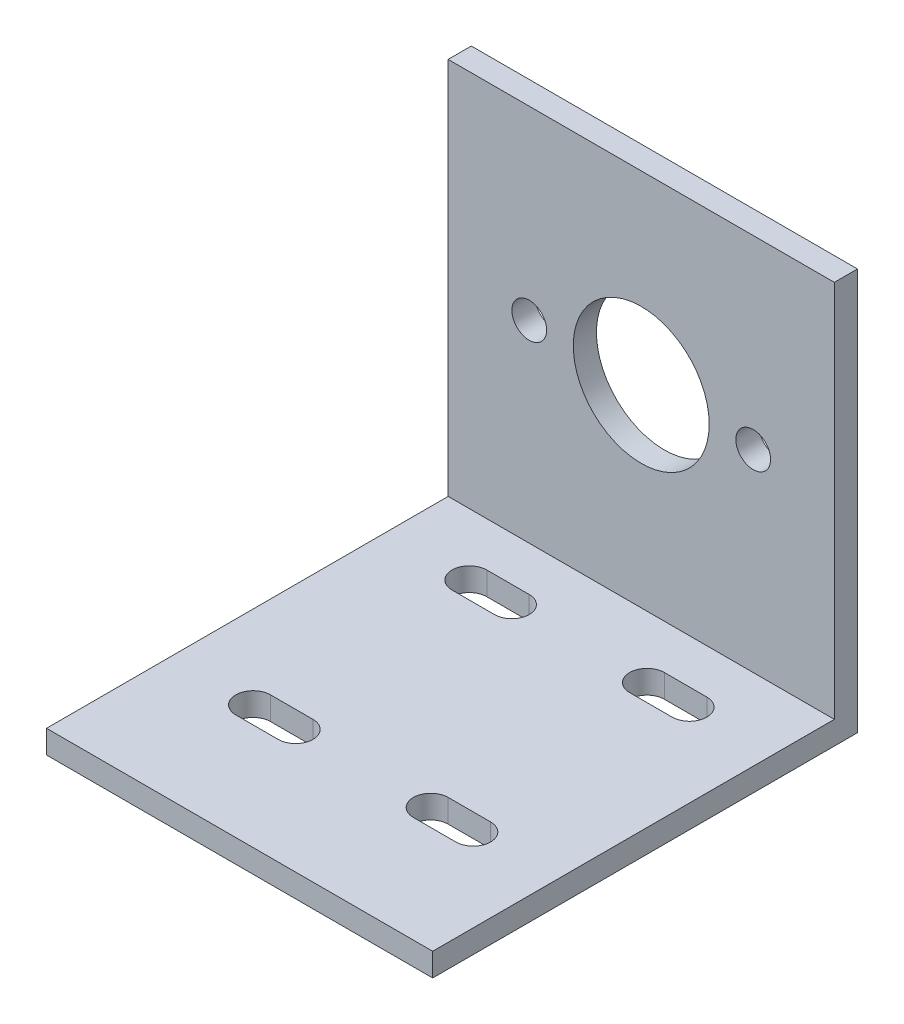
from build123d import *

# Parameters (mm, degrees)
SKIZZE1_W                       = 50
SKIZZE1_H                       = 52
SKIZZE1_R                       = 8.8
SKIZZE1_R_2                     = 2.25
AUFSATZ_LINEAR_AUSTRAGEN1_DEPTH = 3
SKIZZE2_W                       = 50
SKIZZE2_H                       = 2.999801306
AUFSATZ_LINEAR_AUSTRAGEN2_DEPTH = 52
SCHNITT_LINEAR_AUSTRAGEN1_DEPTH = 78.788299069


with BuildPart() as part:
    # Skizze1 → Aufsatz-Linear austragen1 (new body)
    with BuildSketch(Plane.XY):
        Rectangle(SKIZZE1_W, SKIZZE1_H)
        with Locations((0, 2)):
            Circle(SKIZZE1_R, mode=Mode.SUBTRACT)
        with Locations((-14.5, 2)):
            Circle(SKIZZE1_R_2, mode=Mode.SUBTRACT)
        with Locations((14.5, 2)):
            Circle(SKIZZE1_R_2, mode=Mode.SUBTRACT)
    extrude(amount=AUFSATZ_LINEAR_AUSTRAGEN1_DEPTH)

    # Skizze2 → Aufsatz-Linear austragen2 (add)
    with BuildSketch(Plane.XY.offset(3)):
        with Locations((0, -24.500099347)):
            Rectangle(SKIZZE2_W, SKIZZE2_H)
    extrude(amount=AUFSATZ_LINEAR_AUSTRAGEN2_DEPTH)

    # Skizze3 → Schnitt-Linear austragen1 (cut, through all)
    with BuildSketch(Plane(origin=(0, -23.000198694, 0), x_dir=(1, 0, 0), z_dir=(0, 1, 0))):
        with BuildLine():
            Line((-14.25, -36.75), (-8.75, -36.75))
            ThreePointArc((-8.75, -36.75), (-6.5, -39), (-8.75, -41.25))
            Line((-8.75, -41.25), (-14.25, -41.25))
            ThreePointArc((-14.25, -41.25), (-16.5, -39), (-14.25, -36.75))
        make_face()
        with BuildLine():
            Line((8.75, -36.75), (14.25, -36.75))
            ThreePointArc((14.25, -36.75), (16.5, -39), (14.25, -41.25))
            Line((14.25, -41.25), (8.75, -41.25))
            ThreePointArc((8.75, -41.25), (6.5, -39), (8.75, -36.75))
        make_face()
        with BuildLine():
            Line((-14.25, -8.75), (-8.75, -8.75))
            ThreePointArc((-8.75, -8.75), (-6.5, -11), (-8.75, -13.25))
            Line((-8.75, -13.25), (-14.25, -13.25))
            ThreePointArc((-14.25, -13.25), (-16.5, -11), (-14.25, -8.75))
        make_face()
        with BuildLine():
            Line((8.75, -8.75), (14.25, -8.75))
            ThreePointArc((14.25, -8.75), (16.5, -11), (14.25, -13.25))
            Line((14.25, -13.25), (8.75, -13.25))
            ThreePointArc((8.75, -13.25), (6.5, -11), (8.75, -8.75))
        make_face()
    extrude(amount=-SCHNITT_LINEAR_AUSTRAGEN1_DEPTH, mode=Mode.SUBTRACT)


solid = part.part
